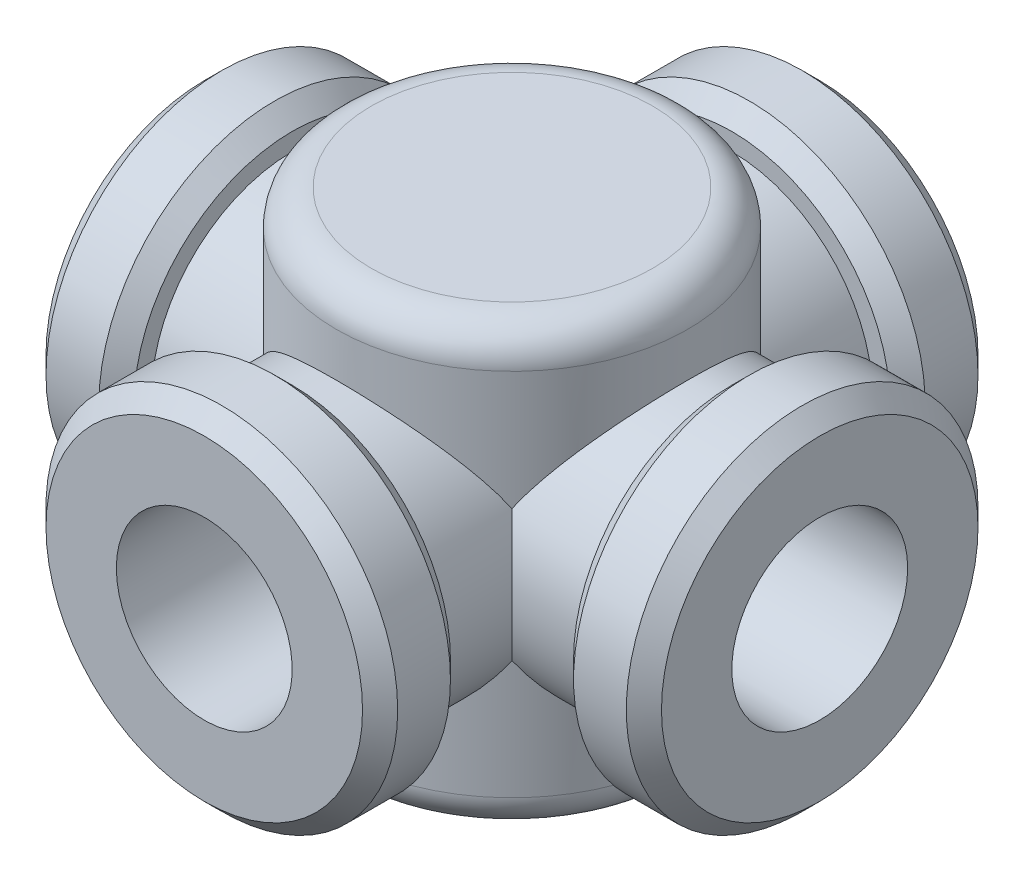
from build123d import *

# Parameters (mm, degrees)
SKETCH3_R           = 5
BOSS_EXTRUDE1_DEPTH = 6.25
FILLET1_R           = 1
SKETCH5_R           = 4
BOSS_EXTRUDE3_DEPTH = 8.75
SKETCH4_R           = 4
BOSS_EXTRUDE4_DEPTH = 8.75
SKETCH6_R           = 2.5
CUT_EXTRUDE3_DEPTH  = 6
SKETCH7_R           = 2.5
CUT_EXTRUDE4_DEPTH  = 6
BOSS_EXTRUDE5_START = -2.5
SKETCH8_R           = 5
SKETCH8_R_2         = 2.5
BOSS_EXTRUDE5_DEPTH = 2.5
SKETCH9_R           = 5
SKETCH9_R_2         = 2.5
BOSS_EXTRUDE6_DEPTH = 2.5
CHAMFER1_SIZE       = 0.5


with BuildPart() as part:
    # Sketch3 → Boss-Extrude1 (new, symmetric)
    with BuildSketch(Plane(origin=(0, 0, 0), x_dir=(1, 0, 0), z_dir=(0, 1, 0))):
        with Locations(Location((0, 0, 0), (0, 0, 270))):
            Circle(SKETCH3_R)
    extrude(amount=BOSS_EXTRUDE1_DEPTH, both=True)

    # Fillet1
    fillet1_edges = [part.edges().sort_by_distance(p)[0] for p in [
        (0, -6.25, -5),
        (0, 6.25, -5),
    ]]
    fillet(fillet1_edges, radius=FILLET1_R)

    # Sketch5 → Boss-Extrude3 (add, symmetric)
    with BuildSketch(Plane.XY):
        with Locations(Location((0, 0, 0), (0, 0, 180))):
            Circle(SKETCH5_R)
    extrude(amount=BOSS_EXTRUDE3_DEPTH, both=True)

    # Sketch4 → Boss-Extrude4 (add, symmetric)
    with BuildSketch(Plane(origin=(0, 0, 0), x_dir=(0, 0, -1), z_dir=(1, 0, 0))):
        with Locations(Location((0, 0, 0), (0, 0, 207.885566817))):
            Circle(SKETCH4_R)
    extrude(amount=BOSS_EXTRUDE4_DEPTH, both=True)

    # Sketch6 → Cut-Extrude3 (cut)
    with BuildSketch(Plane(origin=(8.75, 0, 0), x_dir=(0, 0, -1), z_dir=(1, 0, 0))):
        Circle(SKETCH6_R)
    cut_extrude3 = extrude(amount=-CUT_EXTRUDE3_DEPTH, mode=Mode.SUBTRACT)

    # Sketch7 → Cut-Extrude4 (cut)
    with BuildSketch(Plane(origin=(0, 0, -8.75), x_dir=(-1, 0, 0), z_dir=(0, 0, -1))):
        Circle(SKETCH7_R)
    cut_extrude4 = extrude(amount=-CUT_EXTRUDE4_DEPTH, mode=Mode.SUBTRACT)

    # Sketch8 → Boss-Extrude5 (add)
    with BuildSketch(Plane.ZY.offset(8.75).offset(BOSS_EXTRUDE5_START)):
        Circle(SKETCH8_R)
        with Locations(Location((0, 0, 0), (0, 0, 180))):
            Circle(SKETCH8_R_2, mode=Mode.SUBTRACT)
    boss_extrude5 = extrude(amount=BOSS_EXTRUDE5_DEPTH)

    # Mirror1: Boss-Extrude5 across plane
    add(boss_extrude5.mirror(Plane(origin=(0, 0, 0), x_dir=(0, 0, 1), z_dir=(1, 0, 0))))

    # Sketch9 → Boss-Extrude6 (add)
    with BuildSketch(Plane(origin=(0, 0, -8.75), x_dir=(-1, 0, 0), z_dir=(0, 0, -1))):
        Circle(SKETCH9_R)
        Circle(SKETCH9_R_2, mode=Mode.SUBTRACT)
    boss_extrude6 = extrude(amount=-BOSS_EXTRUDE6_DEPTH)

    # Mirror2: Boss-Extrude6 across plane
    add(boss_extrude6.mirror(Plane.XY))

    # Mirror3: Cut-Extrude3 across plane
    add(cut_extrude3.mirror(Plane(origin=(0, 0, 0), x_dir=(0, 0, 1), z_dir=(1, 0, 0))), mode=Mode.SUBTRACT)

    # Mirror4: Cut-Extrude4 across plane
    add(cut_extrude4.mirror(Plane.XY), mode=Mode.SUBTRACT)

    # Chamfer1
    chamfer1_edges = [part.edges().sort_by_distance(p)[0] for p in [
        (-6.25, 0, -5),
        (-8.75, 0, -5),
        (6.25, 0, -5),
        (8.75, 0, -5),
        (5, 0, -8.75),
        (5, 0, -6.25),
        (5, 0, 6.25),
        (5, 0, 8.75),
    ]]
    chamfer(chamfer1_edges, length=CHAMFER1_SIZE)


solid = part.part
